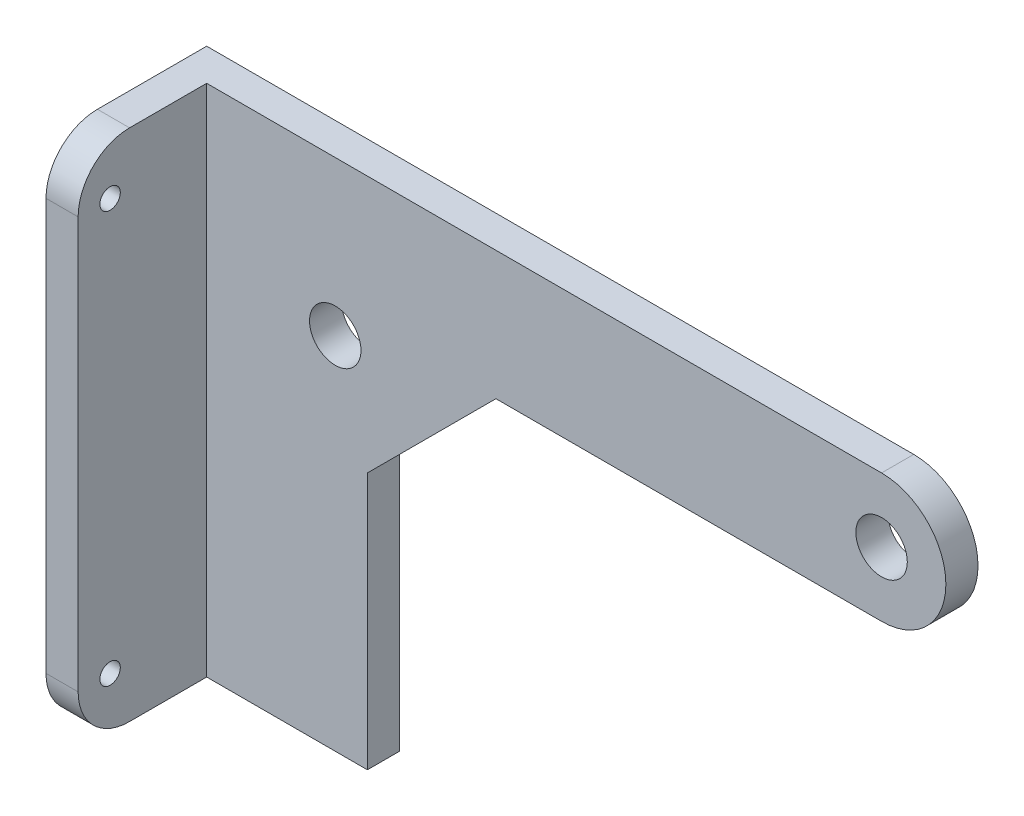
from build123d import *

# Parameters (mm, degrees)
SKETCH1_R           = 20
BOSS_EXTRUDE1_DEPTH = 12.5
SKETCH2_W           = 25
SKETCH2_H           = 400
BOSS_EXTRUDE2_DEPTH = 100
CUT_EXTRUDE1_REACH  = 705.673
SKETCH3_R           = 7.94
FILLET1_R           = 40


with BuildPart() as part:
    # Sketch1 → Boss-Extrude1 (new, symmetric)
    with BuildSketch(Plane.XY):
        with BuildLine():
            Line((405, -50), (105, -50))
            Line((105, -50), (5, -150))
            Line((5, -150), (5, -350))
            Line((5, -350), (-145, -350))
            Line((-145, -350), (-145, 50))
            Line((-145, 50), (405, 50))
            ThreePointArc((405, 50), (455, 0), (405, -50))
        make_face()
        with Locations((405, 0)):
            Circle(SKETCH1_R, mode=Mode.SUBTRACT)
        with Locations((-20, -70)):
            Circle(SKETCH1_R, mode=Mode.SUBTRACT)
    extrude(amount=BOSS_EXTRUDE1_DEPTH, both=True)

    # Sketch2 → Boss-Extrude2 (add)
    with BuildSketch(Plane.XY.offset(12.5)):
        with Locations((-132.5, -150)):
            Rectangle(SKETCH2_W, SKETCH2_H)
    extrude(amount=BOSS_EXTRUDE2_DEPTH)

    # Sketch3 → Cut-Extrude1 (cut, up to next)
    with BuildSketch(Plane.ZY.offset(145), mode=Mode.PRIVATE) as cut_extrude1_sk1:
        with Locations((87.648409676, 10)):
            Circle(SKETCH3_R)
    cut_extrude1_tool1 = extrude(cut_extrude1_sk1.sketch, amount=-CUT_EXTRUDE1_REACH, mode=Mode.PRIVATE) & part.part
    # Sketch3 → Cut-Extrude1 (cut, up to next)
    with BuildSketch(Plane.ZY.offset(145), mode=Mode.PRIVATE) as cut_extrude1_sk2:
        with Locations((87.648409676, -310)):
            Circle(SKETCH3_R)
    cut_extrude1_tool2 = extrude(cut_extrude1_sk2.sketch, amount=-CUT_EXTRUDE1_REACH, mode=Mode.PRIVATE) & part.part
    add(cut_extrude1_tool1.solids().sort_by_distance((-145, 10, 87.64841))[0], mode=Mode.SUBTRACT)
    add(cut_extrude1_tool2.solids().sort_by_distance((-145, -310, 87.64841))[0], mode=Mode.SUBTRACT)

    # Fillet1
    fillet1_edges = [part.edges().sort_by_distance(p)[0] for p in [
        (-132.5, -350, 112.5),
        (-132.5, 50, 112.5),
    ]]
    fillet(fillet1_edges, radius=FILLET1_R)


solid = part.part
